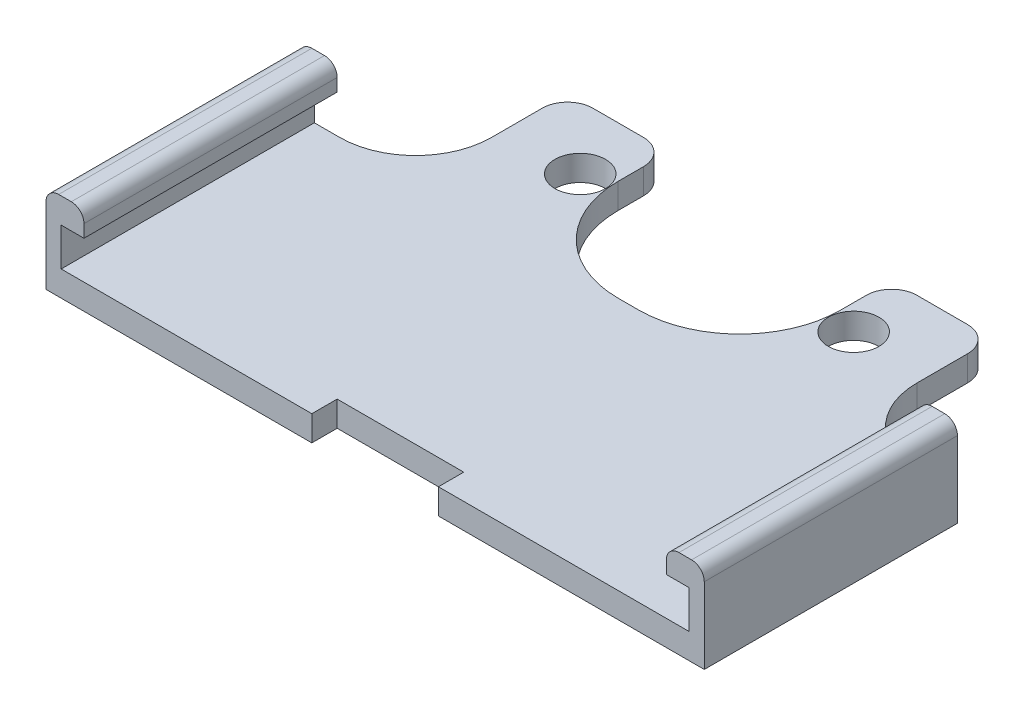
from build123d import *

# Parameters (mm, degrees)
EXTRUDE_1_DEPTH     = 1
SKETCH_3_R          = 1
CUT_EXTRUDE_3_DEPTH = 21.639767441
SKETCH_6_W          = 5
SKETCH_6_H          = 2
CUT_EXTRUDE_4_DEPTH = 21.639767441
SKETCH_7_W          = 0.6
SKETCH_7_H          = 10
EXTRUDE_2_DEPTH     = 1.5
SKETCH_8_W          = 1.5
SKETCH_8_H          = 10
EXTRUDE_3_DEPTH     = 1
FILLET_1_R          = 0.5


with BuildPart() as part:
    # Эскиз1 → Бобышка-Вытянуть1 (new body)
    with BuildSketch(Plane(origin=(0, 0, 0), x_dir=(1, 0, 0), z_dir=(0, 1, 0))):
        with BuildLine():
            Line((-7.4, 16), (-5.4, 16))
            ThreePointArc((-5.4, 16), (-4.692893219, 15.707106781), (-4.4, 15))
            Line((-4.4, 15), (-4.4, 14))
            ThreePointArc((-4.4, 14), (-3.228427125, 11.171572875), (-0.4, 10))
            Line((-0.4, 10), (0.4, 10))
            ThreePointArc((0.4, 10), (3.228427125, 11.171572875), (4.4, 14))
            Line((4.4, 14), (4.4, 15))
            ThreePointArc((4.4, 15), (4.692893219, 15.707106781), (5.4, 16))
            Line((5.4, 16), (7.4, 16))
            ThreePointArc((7.4, 16), (8.107106781, 15.707106781), (8.4, 15))
            Line((8.4, 15), (8.4, 13))
            ThreePointArc((8.4, 13), (9.278679656, 10.878679656), (11.4, 10))
            Line((11.4, 10), (13, 10))
            Line((13, 10), (13, 0))
            Line((13, 0), (-13, 0))
            Line((-13, 0), (-13, 10))
            Line((-13, 10), (-11.4, 10))
            ThreePointArc((-11.4, 10), (-9.278679656, 10.878679656), (-8.4, 13))
            Line((-8.4, 13), (-8.4, 15))
            ThreePointArc((-8.4, 15), (-8.107106781, 15.707106781), (-7.4, 16))
        make_face()
    extrude(amount=-EXTRUDE_1_DEPTH)

    # Эскиз3 → Вырез-Вытянуть3 (cut, through all)
    with BuildSketch(Plane(origin=(0, 0, 0), x_dir=(1, 0, 0), z_dir=(0, 1, 0))):
        with Locations(Location((-5.4, 13.5, 0), (0, 0, 270))):
            Circle(SKETCH_3_R)
        with Locations(Location((5.4, 13.5, 0), (0, 0, 270))):
            Circle(SKETCH_3_R)
    extrude(amount=-CUT_EXTRUDE_3_DEPTH, mode=Mode.SUBTRACT)

    # Эскиз6 → Вырез-Вытянуть4 (cut, through all)
    with BuildSketch(Plane(origin=(0, 0, 0), x_dir=(1, 0, 0), z_dir=(0, 1, 0))):
        Rectangle(SKETCH_6_W, SKETCH_6_H)
    extrude(amount=-CUT_EXTRUDE_4_DEPTH, mode=Mode.SUBTRACT)

    # Эскиз7 → Бобышка-Вытянуть2 (add)
    with BuildSketch(Plane(origin=(0, 0, 0), x_dir=(1, 0, 0), z_dir=(0, 1, 0))):
        with Locations((-12.7, 5)):
            Rectangle(SKETCH_7_W, SKETCH_7_H)
        with Locations((12.7, 5)):
            Rectangle(SKETCH_7_W, SKETCH_7_H)
    extrude(amount=EXTRUDE_2_DEPTH)

    # Эскиз8 → Бобышка-Вытянуть3 (add)
    with BuildSketch(Plane(origin=(0, 1.5, 0), x_dir=(1, 0, 0), z_dir=(0, 1, 0))):
        with Locations((-12.25, 5)):
            Rectangle(SKETCH_8_W, SKETCH_8_H)
        with Locations((12.25, 5)):
            Rectangle(SKETCH_8_W, SKETCH_8_H)
    extrude(amount=EXTRUDE_3_DEPTH)

    # Скругление1
    fillet_1_edges = [part.edges().sort_by_distance(p)[0] for p in [
        (-13, 2.5, -5),
        (-11.5, 2.5, -5),
        (13, 2.5, -5),
        (11.5, 2.5, -5),
    ]]
    fillet(fillet_1_edges, radius=FILLET_1_R)


solid = part.part
